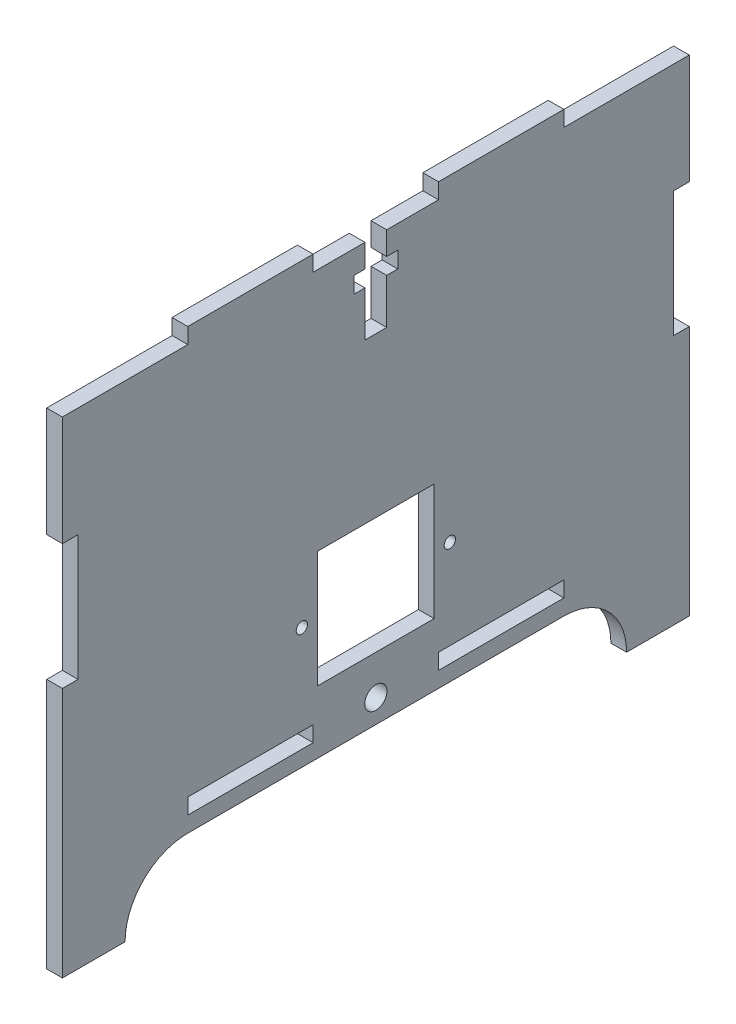
from build123d import *

# Parameters (mm, degrees)
SKETCH1_W                 = 127
SKETCH1_H                 = 101.6
BOSS_EXTRUDE1_DEPTH       = 3.175
SKETCH2_W                 = 25.4
SKETCH2_H                 = 3.175
CUT_EXTRUDE1_DEPTH        = 6.35
LPATTERN1_COUNT           = 3
LPATTERN1_PITCH           = 50.8
CUT_EXTRUDE4_DEPTH        = 6.35
SKETCH8_W                 = 3.175
SKETCH8_H                 = 25.4
CUT_EXTRUDE6_DEPTH        = 6.35
SKETCH9_W                 = 25.4
SKETCH9_H                 = 3.175
CUT_EXTRUDE7_DEPTH        = 6.35
LPATTERN6_COUNT           = 2
LPATTERN6_PITCH           = 50.8
SKETCH16_W                = 4.3942
SKETCH16_H                = 17.145
SKETCH16_W_2              = 8.89
SKETCH16_H_2              = 3.302
CUT_EXTRUDE14_DEPTH       = 6.35
F_8_CLEARANCE_HOLE1_D     = 4.4958
F_8_CLEARANCE_HOLE1_DEPTH = 10.16
F_8_CLEARANCE_HOLE1_TIP   = 1.350674586
SKETCH20_R                = 1.143
SKETCH20_W                = 23.622
SKETCH20_H                = 23.622
CUT_EXTRUDE16_DEPTH       = 10.16


with BuildPart() as part:
    # Sketch1 → Boss-Extrude1 (new body)
    with BuildSketch(Plane(origin=(0, 0, 0), x_dir=(0, 0, -1), z_dir=(1, 0, 0))):
        Rectangle(SKETCH1_W, SKETCH1_H)
    extrude(amount=BOSS_EXTRUDE1_DEPTH)

    # Sketch2 → Cut-Extrude1 (cut)
    with BuildSketch(Plane(origin=(3.175, 0, 0), x_dir=(0, 0, -1), z_dir=(1, 0, 0))):
        with Locations((-50.8, 49.2125)):
            Rectangle(SKETCH2_W, SKETCH2_H)
    cut_extrude1 = extrude(amount=-CUT_EXTRUDE1_DEPTH, mode=Mode.SUBTRACT)

    # LPattern1: Cut-Extrude1 ×3
    with Locations(*[(0, 0, -i * LPATTERN1_PITCH) for i in range(1, LPATTERN1_COUNT)]):
        add(cut_extrude1, mode=Mode.SUBTRACT)

    # Sketch5 → Cut-Extrude4 (cut)
    with BuildSketch(Plane(origin=(3.175, 0, 0), x_dir=(0, 0, -1), z_dir=(1, 0, 0))):
        with BuildLine():
            Line((-38.1, -38.1), (38.1, -38.1))
            ThreePointArc((38.1, -38.1), (50.8, -50.8), (38.1, -63.5))
            Line((38.1, -63.5), (-38.1, -63.5))
            ThreePointArc((-38.1, -63.5), (-50.8, -50.8), (-38.1, -38.1))
        make_face()
    extrude(amount=-CUT_EXTRUDE4_DEPTH, mode=Mode.SUBTRACT)

    # Sketch8 → Cut-Extrude6 (cut)
    with BuildSketch(Plane(origin=(3.175, 0, 0), x_dir=(0, 0, -1), z_dir=(1, 0, 0))):
        with Locations((61.9125, 12.7)):
            Rectangle(SKETCH8_W, SKETCH8_H)
    cut_extrude6 = extrude(amount=-CUT_EXTRUDE6_DEPTH, mode=Mode.SUBTRACT)

    # Sketch9 → Cut-Extrude7 (cut)
    with BuildSketch(Plane.ZY):
        with Locations((-25.4, -33.3375)):
            Rectangle(SKETCH9_W, SKETCH9_H)
    cut_extrude7 = extrude(amount=-CUT_EXTRUDE7_DEPTH, mode=Mode.SUBTRACT)

    # LPattern6: Cut-Extrude7 ×2
    with Locations(*[(0, 0, i * LPATTERN6_PITCH) for i in range(1, LPATTERN6_COUNT)]):
        add(cut_extrude7, mode=Mode.SUBTRACT)

    # Sketch16 → Cut-Extrude14 (cut)
    with BuildSketch(Plane.ZY):
        with Locations((0, 39.0525)):
            Rectangle(SKETCH16_W, SKETCH16_H)
        with Locations((0, 41.275)):
            Rectangle(SKETCH16_W_2, SKETCH16_H_2)
    extrude(amount=-CUT_EXTRUDE14_DEPTH, mode=Mode.SUBTRACT)

    # #8 Clearance Hole1
    with Locations(Plane.ZY):
        with Locations((0, -33.3375)):
            Hole(F_8_CLEARANCE_HOLE1_D / 2, depth=F_8_CLEARANCE_HOLE1_DEPTH)
            with Locations((0, 0, -(F_8_CLEARANCE_HOLE1_DEPTH + F_8_CLEARANCE_HOLE1_TIP / 2))):  # 118° drill point
                Cone(0, F_8_CLEARANCE_HOLE1_D / 2, F_8_CLEARANCE_HOLE1_TIP, mode=Mode.SUBTRACT)

    # Sketch20 → Cut-Extrude16 (cut)
    with BuildSketch(Plane.ZY):
        with Locations((-14.986, -13.589)):
            Circle(SKETCH20_R)
        with Locations((14.986, -13.589)):
            Circle(SKETCH20_R)
        with Locations((0, -13.589)):
            Rectangle(SKETCH20_W, SKETCH20_H)
    extrude(amount=-CUT_EXTRUDE16_DEPTH, mode=Mode.SUBTRACT)

    # Mirror3: Cut-Extrude6 across plane
    add(cut_extrude6.mirror(Plane.XY), mode=Mode.SUBTRACT)


solid = part.part
